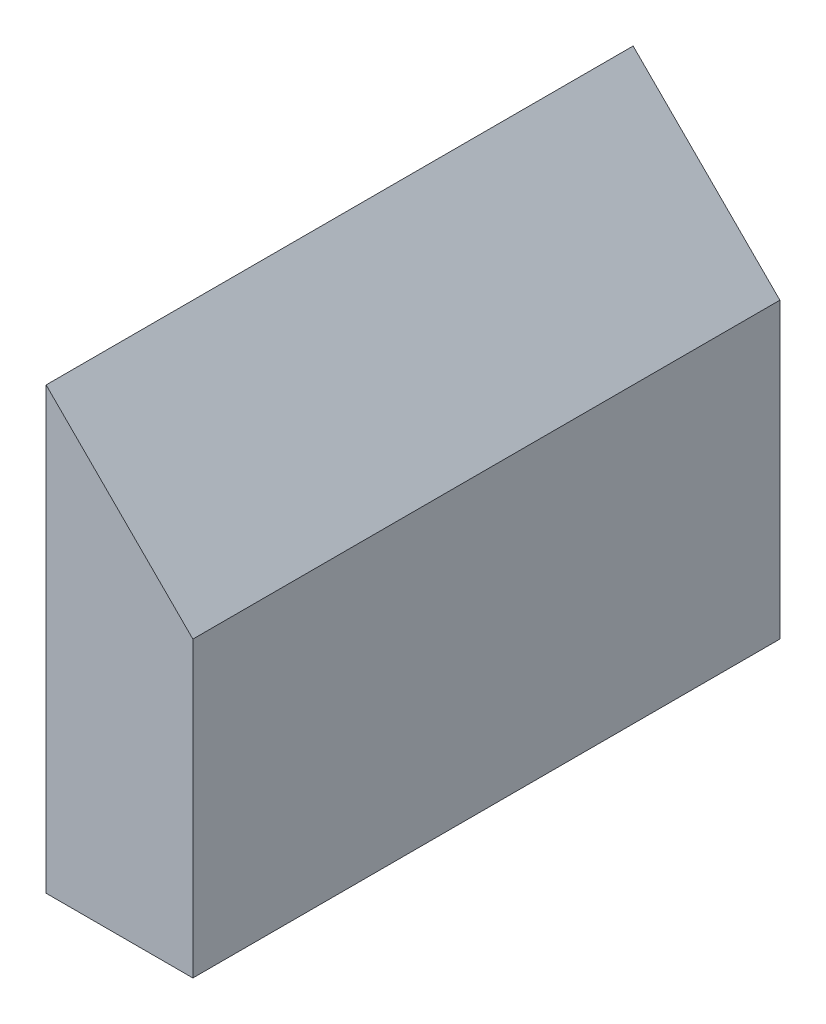
from build123d import *

# Parameters (mm, degrees)
BOSS_EXTRUDE1_DEPTH = 40


with BuildPart() as part:
    # Sketch3 → Boss-Extrude1 (new body)
    with BuildSketch(Plane.XY):
        Polygon((0, 0), (0, 30), (10, 20), (10, 0), align=None)
    extrude(amount=BOSS_EXTRUDE1_DEPTH)


solid = part.part
